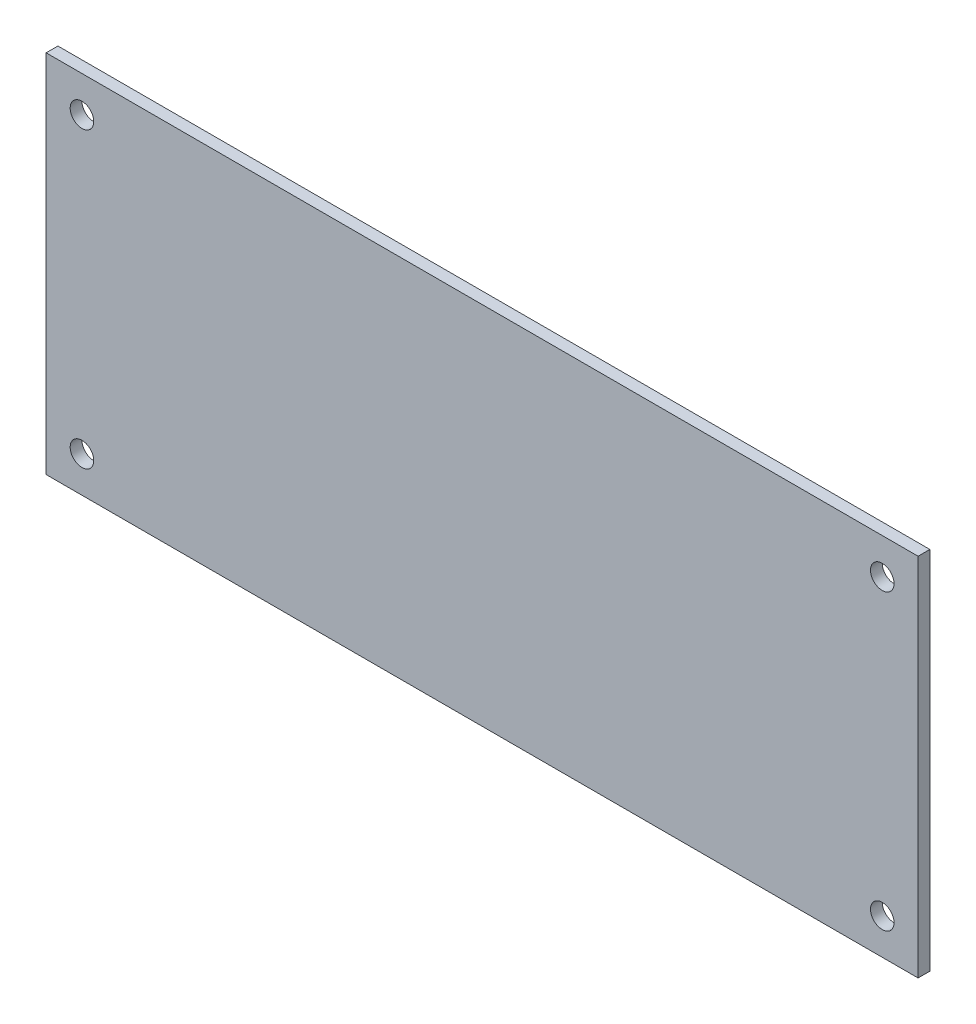
from build123d import *

# Parameters (mm, degrees)
SKETCH1_W           = 234.95
SKETCH1_H           = 98.425
BOSS_EXTRUDE1_DEPTH = 3.175
SKETCH2_R           = 3.175
CUT_EXTRUDE1_DEPTH  = 128.406147443


with BuildPart() as part:
    # Sketch1 → Boss-Extrude1 (new body)
    with BuildSketch(Plane.XY):
        Rectangle(SKETCH1_W, SKETCH1_H)
    extrude(amount=BOSS_EXTRUDE1_DEPTH)

    # Sketch2 → Cut-Extrude1 (cut, through all)
    with BuildSketch(Plane.XY.offset(3.175)):
        with Locations((-107.823, 39.5605)):
            Circle(SKETCH2_R)
        with Locations((-107.823, -39.5605)):
            Circle(SKETCH2_R)
        with Locations((107.823, 39.5605)):
            Circle(SKETCH2_R)
        with Locations((107.823, -39.5605)):
            Circle(SKETCH2_R)
    extrude(amount=-CUT_EXTRUDE1_DEPTH, mode=Mode.SUBTRACT)


solid = part.part
